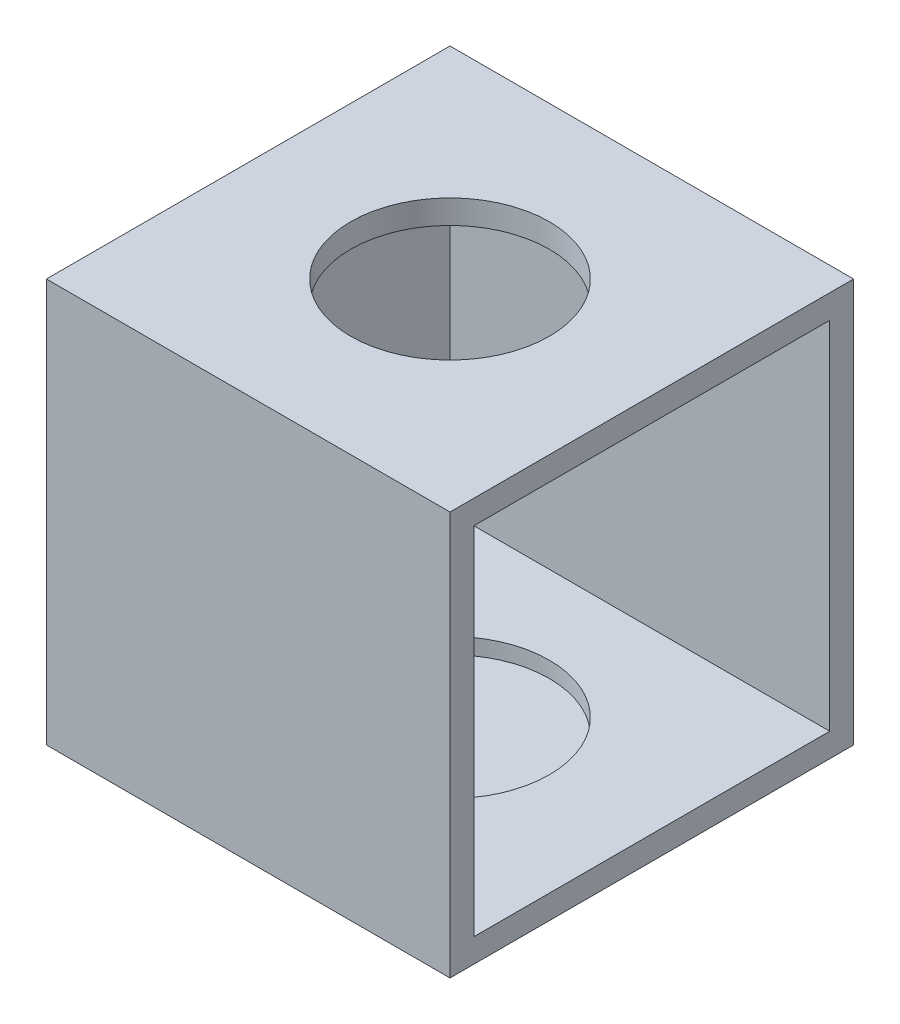
from build123d import *

# Parameters (mm, degrees)
SKETCH1_W           = 50.8
SKETCH1_H           = 50.8
BOSS_EXTRUDE1_DEPTH = 50.8
SHELL1_T            = -3
SKETCH2_R           = 3.175
CUT_EXTRUDE1_DEPTH  = 50.8
SKETCH3_R           = 12.5
CUT_EXTRUDE2_DEPTH  = 49.8
SKETCH4_W           = 25
SKETCH4_H           = 6
CUT_EXTRUDE3_DEPTH  = 49.8


with BuildPart() as part:
    # Sketch1 → Boss-Extrude1 (new body)
    with BuildSketch(Plane(origin=(0, 0, 0), x_dir=(1, 0, 0), z_dir=(0, 1, 0))):
        Rectangle(SKETCH1_W, SKETCH1_H)
    extrude(amount=BOSS_EXTRUDE1_DEPTH)

    # Shell1
    shell1_openings = [part.faces().sort_by_distance(p)[0] for p in [
        (25.4, 25.4, 0),
    ]]
    offset(amount=SHELL1_T, openings=shell1_openings, kind=Kind.INTERSECTION)

    # Sketch2 → Cut-Extrude1 (cut)
    with BuildSketch(Plane.ZY.offset(25.4)):
        with Locations((0, 25.4)):
            Circle(SKETCH2_R)
    extrude(amount=-CUT_EXTRUDE1_DEPTH, mode=Mode.SUBTRACT)

    # Sketch3 → Cut-Extrude2 (cut)
    with BuildSketch(Plane(origin=(0, 50.8, 0), x_dir=(1, 0, 0), z_dir=(0, 1, 0))):
        with Locations(Location((0, 0, 0), (0, 0, 270))):
            Circle(SKETCH3_R)
    extrude(amount=-CUT_EXTRUDE2_DEPTH, mode=Mode.SUBTRACT)

    # Sketch4 → Cut-Extrude3 (cut)
    with BuildSketch(Plane(origin=(-22.4, 0, 0), x_dir=(0, 0, -1), z_dir=(1, 0, 0))):
        with Locations((0, 43.442725036)):
            Rectangle(SKETCH4_W, SKETCH4_H)
    extrude(amount=-CUT_EXTRUDE3_DEPTH, mode=Mode.SUBTRACT)


solid = part.part
